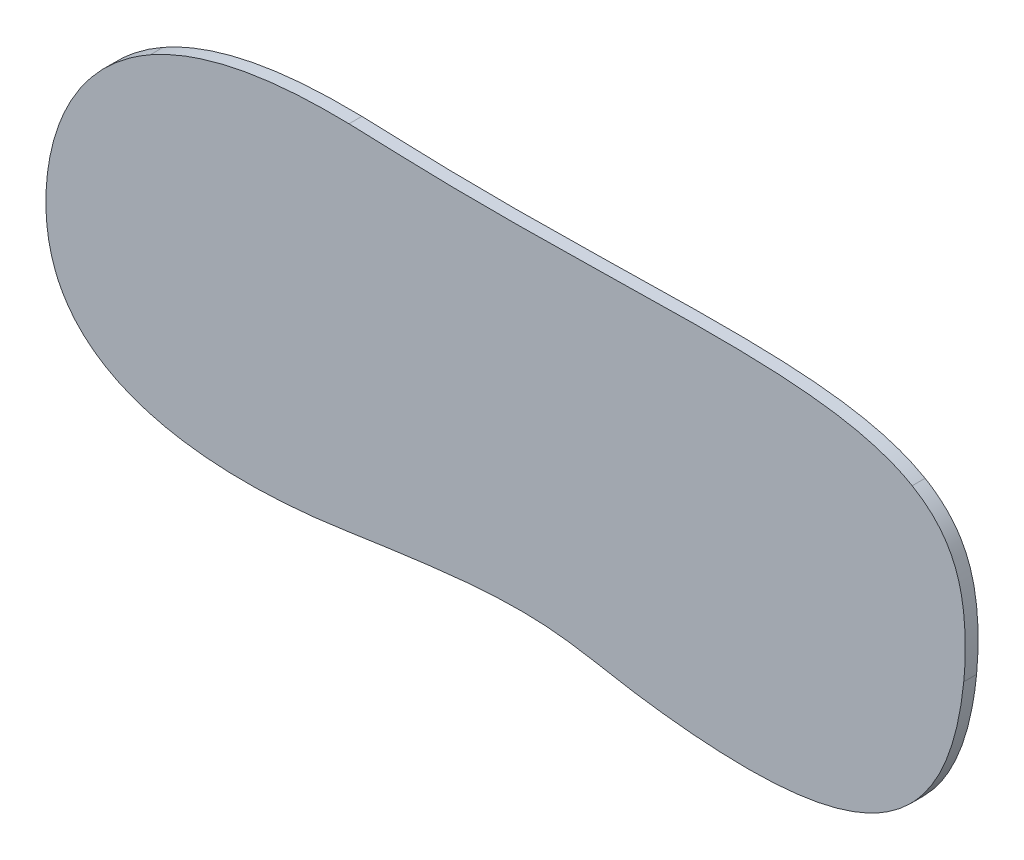
from build123d import *

# Parameters (mm, degrees)
BOSS_EXTRUDE1_DEPTH = 2


with BuildPart() as part:
    # Sketch1 → Boss-Extrude1 (new body)
    with BuildSketch(Plane.XY):
        with BuildLine():
            add(Edge.make_bspline(
                [(42.254959693, 0.147059904), (42.358632415, 1.199419601), (42.431093, 2.252519668), (42.507895564, 4.360335613), (42.512403958, 5.415047543), (42.438944283, 7.526427791), (42.360968868, 8.583113716), (42.09865974, 10.66975069), (41.915389515, 11.702985715), (41.523005817, 13.230108257), (41.372062824, 13.735250738), (41.022066924, 14.73622728), (40.822896185, 15.231629468), (40.159240455, 16.669554621), (39.624677549, 17.574204207), (38.670446405, 18.841910545), (38.324763751, 19.251561585), (37.599094102, 20.022250678), (37.217891586, 20.385301348), (36.024008603, 21.413431301), (35.161096788, 22.017542036), (34.242840394, 22.554478016)],
                knots=[0, 0, 0, 0, 0.125, 0.125, 0.25, 0.25, 0.375, 0.375, 0.5, 0.5, 0.5625, 0.5625, 0.625, 0.625, 0.75, 0.75, 0.8125, 0.8125, 0.875, 0.875, 1, 1, 1, 1], degree=3))
            add(Edge.make_bspline(
                [(34.242840394, 22.554478016), (33.432163344, 23.028508667), (32.600124174, 23.438064349), (30.904833088, 24.162969666), (30.041468461, 24.47797912), (27.41581999, 25.315696923), (25.618305059, 25.732071103), (22.878935407, 26.226556605), (21.962590487, 26.36834517), (20.131401643, 26.615298727), (19.215351389, 26.720560508), (16.466137493, 26.993863209), (14.63191251, 27.119493097), (10.961693588, 27.300065699), (9.125685095, 27.354426791), (5.452541451, 27.418127948), (3.615398198, 27.42714421), (-1.897049716, 27.413507708), (-5.573357064, 27.350787708), (-12.926321579, 27.211369022), (-16.602922737, 27.133521657), (-23.955526241, 27.019717914), (-27.631613941, 26.983286898), (-34.982928847, 26.992718318), (-38.658158316, 27.038364256), (-43.251446787, 27.166991695), (-44.170067215, 27.19628112), (-46.007228743, 27.262446519), (-46.925770125, 27.29929548), (-49.681420206, 27.407362262), (-51.518563422, 27.475278936), (-53.356065443, 27.50888127)],
                knots=[0, 0, 0, 0, 0.03125, 0.03125, 0.0625, 0.0625, 0.125, 0.125, 0.15625, 0.15625, 0.1875, 0.1875, 0.25, 0.25, 0.3125, 0.3125, 0.375, 0.375, 0.5, 0.5, 0.625, 0.625, 0.75, 0.75, 0.875, 0.875, 0.90625, 0.90625, 0.9375, 0.9375, 1, 1, 1, 1], degree=3))
            add(Edge.make_bspline(
                [(-53.356065443, 27.50888127), (-56.022208632, 27.557636935), (-58.687136141, 27.53681843), (-64.012146511, 27.217918735), (-66.660366647, 26.927787667), (-70.601424233, 26.237218613), (-71.904117187, 25.965044304), (-74.474456216, 25.328685725), (-75.743641602, 24.96426376), (-79.496955186, 23.714072096), (-81.927745995, 22.673995356), (-84.262184454, 21.355167704)],
                knots=[0, 0, 0, 0, 0.25, 0.25, 0.5, 0.5, 0.625, 0.625, 0.75, 0.75, 1, 1, 1, 1], degree=3))
            add(Edge.make_bspline(
                [(-84.262184454, 21.355167704), (-86.278341457, 20.216151339), (-88.167221142, 18.89851058), (-90.34366433, 16.992307868), (-90.768414988, 16.599049831), (-91.590733965, 15.793897042), (-91.989215087, 15.381213437), (-93.146643825, 14.112857312), (-93.867615548, 13.226910361), (-95.207536565, 11.373684045), (-95.826506992, 10.406421529), (-96.676800294, 8.893216637), (-96.945891985, 8.380577294), (-97.45236363, 7.346658391), (-97.690383073, 6.824254117), (-98.806780685, 4.185861085), (-99.466850905, 1.991755978), (-99.902955458, -0.282489958)],
                knots=[0, 0, 0, 0, 0.25, 0.25, 0.3125, 0.3125, 0.375, 0.375, 0.5, 0.5, 0.625, 0.625, 0.6875, 0.6875, 0.75, 0.75, 1, 1, 1, 1], degree=3))
            add(Edge.make_bspline(
                [(-99.902955458, -0.282489958), (-100.174621796, -1.699205431), (-100.353361942, -3.118023586), (-100.530781956, -5.9597342), (-100.532561332, -7.382556525), (-100.367802656, -9.520578475), (-100.284580608, -10.233892872), (-100.050253317, -11.662057688), (-99.900428704, -12.367976371), (-99.530192584, -13.753930956), (-99.309610645, -14.435173261), (-98.789838053, -15.771646269), (-98.490133116, -16.4279006), (-97.463041163, -18.346936536), (-96.63373901, -19.511855047), (-95.424681248, -20.83151487), (-95.174253541, -21.088626653), (-94.656379787, -21.589379224), (-94.388093213, -21.833728916), (-93.564307826, -22.541526745), (-92.993127018, -22.97746297), (-91.222337094, -24.191738503), (-89.965884486, -24.877204756), (-87.992116497, -25.759847021), (-87.319984861, -26.02933053), (-85.962672705, -26.519685162), (-85.275750706, -26.741373503), (-84.58173062, -26.942891461)],
                knots=[0, 0, 0, 0, 0.125, 0.125, 0.25, 0.25, 0.3125, 0.3125, 0.375, 0.375, 0.4375, 0.4375, 0.5, 0.5, 0.625, 0.625, 0.65625, 0.65625, 0.6875, 0.6875, 0.75, 0.75, 0.875, 0.875, 0.9375, 0.9375, 1, 1, 1, 1], degree=3))
            add(Edge.make_bspline(
                [(-84.58173062, -26.942891461), (-83.326809321, -27.307274542), (-82.058756151, -27.602568632), (-79.502273692, -28.085954606), (-78.213801943, -28.2738231), (-74.323458733, -28.706278362), (-71.719026847, -28.819366471), (-66.501832883, -28.801867744), (-63.90047355, -28.670128954), (-60.012859191, -28.332580381), (-58.719022229, -28.196395499), (-56.781052152, -27.959713991), (-56.13553305, -27.875341554), (-54.84536933, -27.696423192), (-54.200712464, -27.602019753), (-53.556082534, -27.507302947)],
                knots=[0, 0, 0, 0, 0.125, 0.125, 0.25, 0.25, 0.5, 0.5, 0.75, 0.75, 0.875, 0.875, 0.9375, 0.9375, 1, 1, 1, 1], degree=3))
            add(Edge.make_bspline(
                [(-53.556082534, -27.507302947), (-49.465588578, -26.906278231), (-45.375270259, -26.303991445), (-39.2199843, -25.542898217), (-37.166119794, -25.313351344), (-33.050915381, -24.943457655), (-30.989571362, -24.802796264), (-26.853536993, -24.679431241), (-24.793222959, -24.69987176), (-21.723985805, -24.905483185), (-20.704205352, -25.002879486), (-18.670803274, -25.25155515), (-17.657172234, -25.402752145), (-14.621863726, -25.905202423), (-12.605112903, -26.299558503), (-9.571361183, -26.815628995), (-8.558804834, -26.976228369), (-6.530091249, -27.265923265), (-5.513945855, -27.395122387), (-4.496106034, -27.509497112)],
                knots=[0, 0, 0, 0, 0.25, 0.25, 0.375, 0.375, 0.5, 0.5, 0.625, 0.625, 0.6875, 0.6875, 0.75, 0.75, 0.875, 0.875, 0.9375, 0.9375, 1, 1, 1, 1], degree=3))
            add(Edge.make_bspline(
                [(-4.496106034, -27.509497112), (-2.821884664, -27.715285799), (-1.14442964, -27.878916637), (2.215099222, -28.145961833), (3.897362148, -28.246911018), (7.268558764, -28.361841173), (8.954231619, -28.375809142), (12.319177747, -28.287766615), (13.999311803, -28.186071246), (16.514718079, -27.915300175), (17.352991891, -27.805233486), (19.014710967, -27.540206182), (19.839577202, -27.385118383), (22.293798145, -26.843100868), (23.902840376, -26.379662939), (25.868128224, -25.627047386), (26.258870517, -25.467803642), (27.03531838, -25.130345022), (27.420730864, -24.952171991), (28.556481271, -24.393216735), (29.290353849, -23.986272043), (31.417641791, -22.655965297), (32.736351758, -21.622577389), (33.943321367, -20.424618656)],
                knots=[0, 0, 0, 0, 0.125, 0.125, 0.25, 0.25, 0.375, 0.375, 0.5, 0.5, 0.5625, 0.5625, 0.625, 0.625, 0.75, 0.75, 0.78125, 0.78125, 0.8125, 0.8125, 0.875, 0.875, 1, 1, 1, 1], degree=3))
            add(Edge.make_bspline(
                [(33.943321367, -20.424618656), (35.292996532, -19.085019764), (36.448253132, -17.594173169), (37.928392902, -15.161280487), (38.373614318, -14.327377943), (39.177339179, -12.629397714), (39.536733372, -11.763749893), (40.182870032, -10.003957398), (40.469832135, -9.109898874), (40.980178033, -7.296843923), (41.203899109, -6.375966058), (41.789035837, -3.602655454), (42.069485345, -1.73565064), (42.254959693, 0.147059904)],
                knots=[0, 0, 0, 0, 0.25, 0.25, 0.375, 0.375, 0.5, 0.5, 0.625, 0.625, 0.75, 0.75, 1, 1, 1, 1], degree=3))
        make_face()
    extrude(amount=BOSS_EXTRUDE1_DEPTH)


solid = part.part
